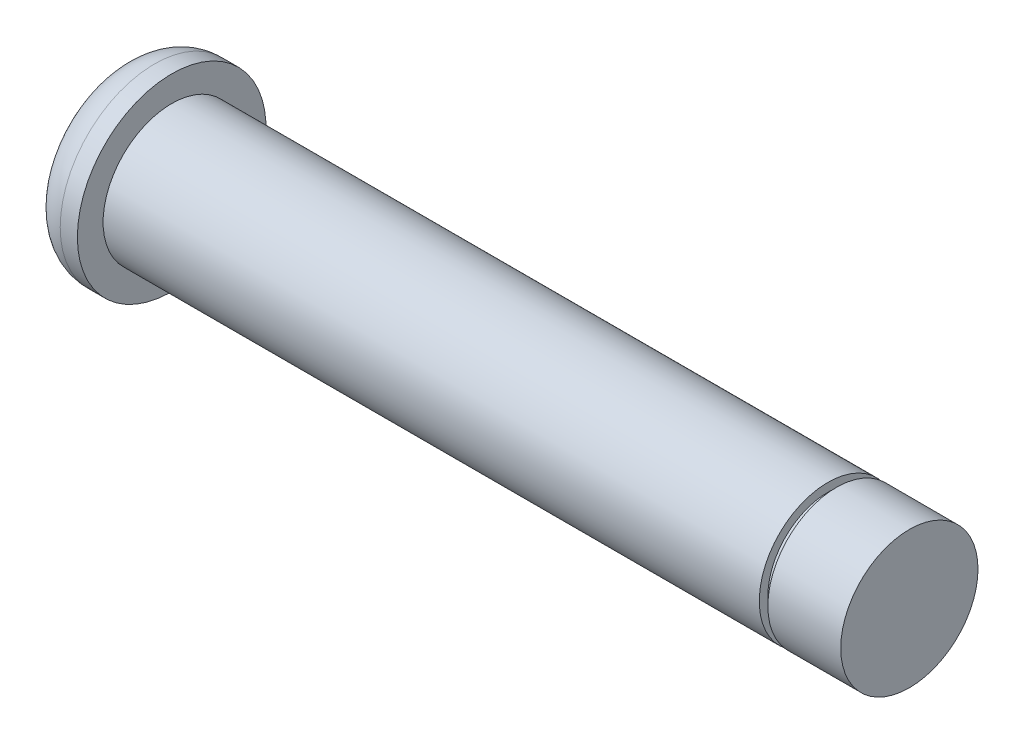
from build123d import *

# Parameters (mm, degrees)
SKETCH1_R           = 4
BOSS_EXTRUDE1_DEPTH = 43
SKETCH2_R           = 5.5
BOSS_EXTRUDE2_DEPTH = 3
FILLET1_R           = 2
SKETCH3_W           = 0.5
SKETCH3_H           = 1


with BuildPart() as part:
    # Sketch1 → Boss-Extrude1 (new body)
    with BuildSketch(Plane(origin=(0, 0, 0), x_dir=(0, 0, -1), z_dir=(1, 0, 0))):
        Circle(SKETCH1_R)
    extrude(amount=BOSS_EXTRUDE1_DEPTH)

    # Sketch2 → Boss-Extrude2 (add)
    with BuildSketch(Plane.ZY):
        Circle(SKETCH2_R)
    extrude(amount=BOSS_EXTRUDE2_DEPTH)

    # Fillet1
    fillet1_edges = [part.edges().sort_by_distance(p)[0] for p in [
        (-3, 0, -5.5),
    ]]
    fillet(fillet1_edges, radius=FILLET1_R)

    # Sketch3 → Cut-Revolve1 (revolve, cut)
    with BuildSketch(Plane.XY, mode=Mode.PRIVATE) as cut_revolve1_sk:
        with Locations((38.5, 4)):
            Rectangle(SKETCH3_W, SKETCH3_H)
    revolve(cut_revolve1_sk.sketch.rotate(Axis((0, 0, 0), (1, 0, 0)), 90), axis=Axis((0, 0, 0), (1, 0, 0)), mode=Mode.SUBTRACT)


solid = part.part
